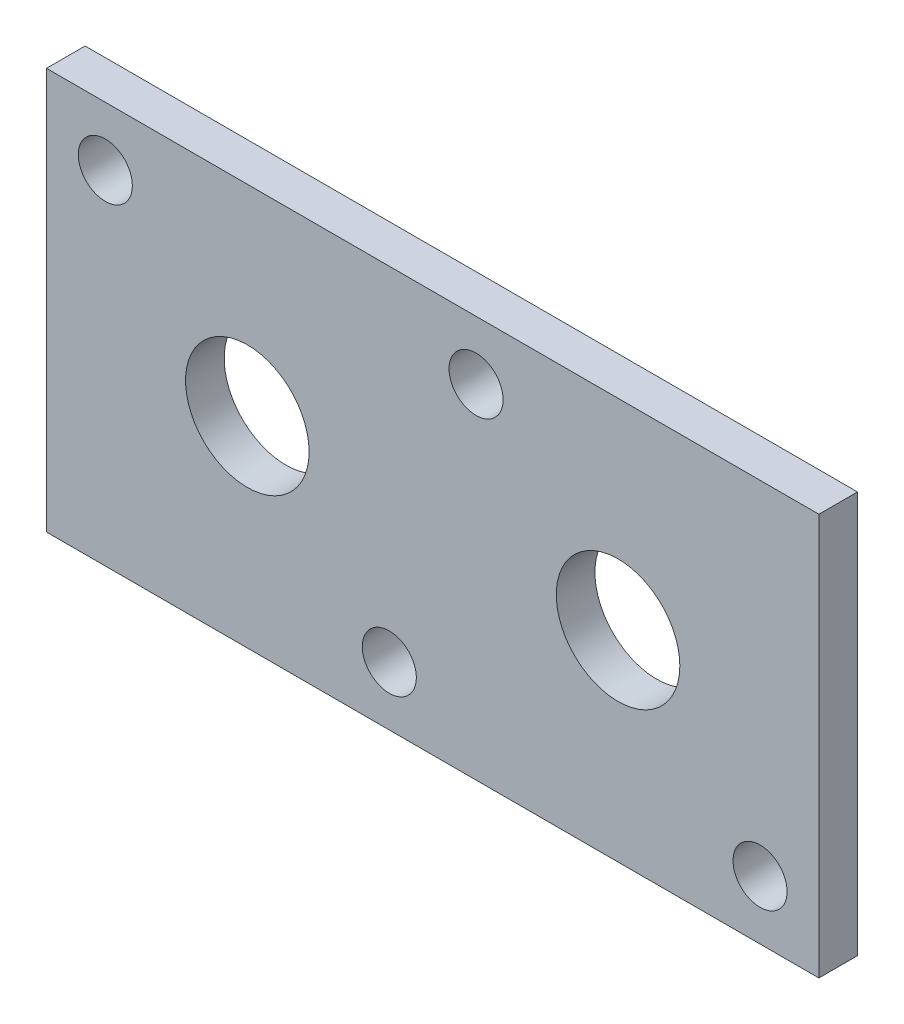
from build123d import *

# Parameters (mm, degrees)
SKETCH_1_W      = 100
SKETCH_1_H      = 52
SKETCH_1_R      = 8
SKETCH_1_R_2    = 3.5
EXTRUDE_1_DEPTH = 5


with BuildPart() as part:
    # 스케치1 → 보스-돌출1 (new body)
    with BuildSketch(Plane.XY):
        Rectangle(SKETCH_1_W, SKETCH_1_H)
        with Locations((24, 0)):
            Circle(SKETCH_1_R, mode=Mode.SUBTRACT)
        with Locations((-24, 0)):
            Circle(SKETCH_1_R, mode=Mode.SUBTRACT)
        with Locations((-42.384776311, 18.384776311)):
            Circle(SKETCH_1_R_2, mode=Mode.SUBTRACT)
        with Locations((-5.615223689, -18.384776311)):
            Circle(SKETCH_1_R_2, mode=Mode.SUBTRACT)
        with Locations((5.615223689, 18.384776311)):
            Circle(SKETCH_1_R_2, mode=Mode.SUBTRACT)
        with Locations((42.384776311, -18.384776311)):
            Circle(SKETCH_1_R_2, mode=Mode.SUBTRACT)
    extrude(amount=EXTRUDE_1_DEPTH)


solid = part.part
